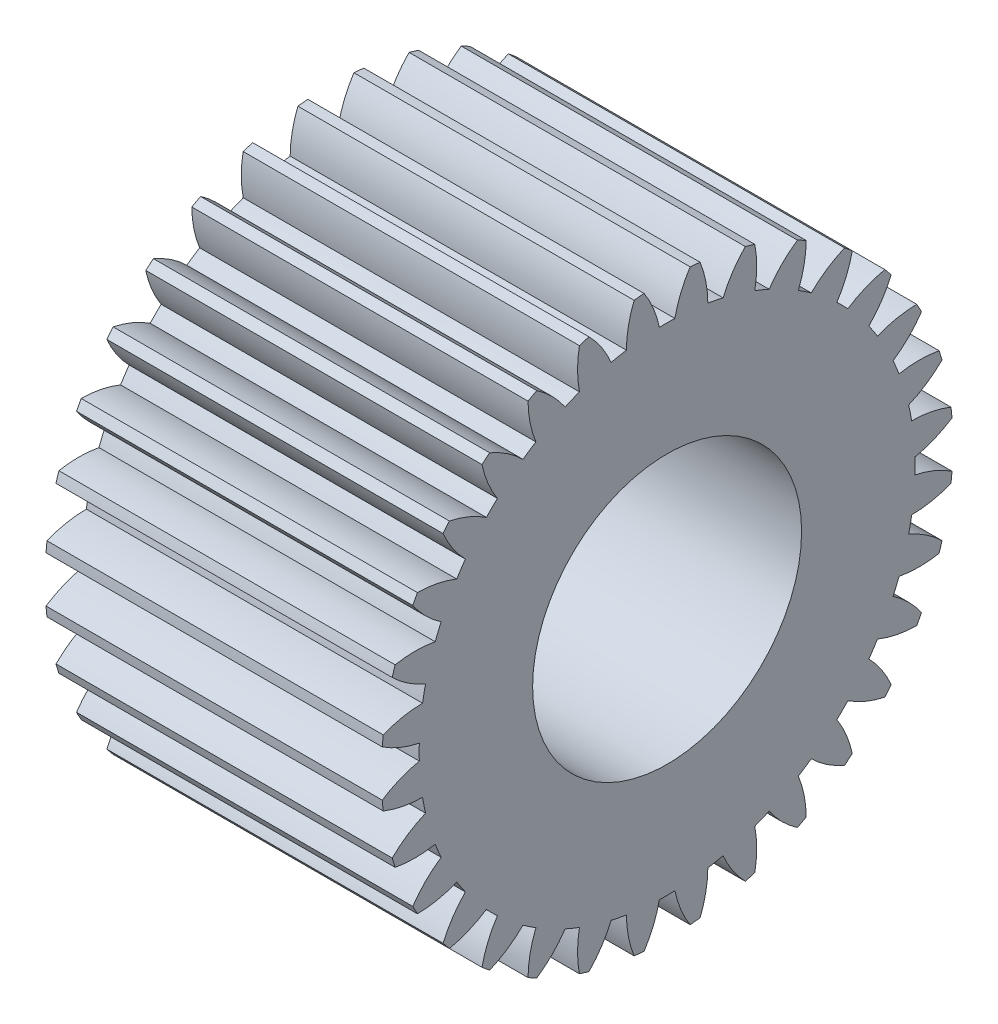
from build123d import *

# Parameters (mm, degrees)
BASPROSKE_W     = 10
BASPROSKE_H     = 8.5
TOOTHCUT_DEPTH  = 16.636495771
TEETHCUTS_COUNT = 32
TEETHCUTS_ANGLE = 348.75
BORSKE_R        = 4
BORE_DEPTH      = 50.0000508


with BuildPart() as part:
    # BasProSke → Base-Revolve (revolve)
    with BuildSketch(Plane(origin=(0, 0, 0), x_dir=(1, 0, 0), z_dir=(0, 1, 0)), mode=Mode.PRIVATE) as base_revolve_sk:
        with Locations((5, 4.25)):
            Rectangle(BASPROSKE_W, BASPROSKE_H)
    revolve(base_revolve_sk.sketch.rotate(Axis((-10, 0, 0), (1, 0, 0)), 180), axis=Axis((-10, 0, 0), (1, 0, 0)))

    # TooCutSke → ToothCut (cut, through all)
    with BuildSketch(Plane(origin=(0, 0, 0), x_dir=(0, 0, -1), z_dir=(1, 0, 0))):
        with BuildLine():
            ThreePointArc((0.230915662, 7.370383569), (0, 7.374), (-0.230915662, 7.370383569))
            ThreePointArc((-0.230915662, 7.370383569), (-0.411960263, 7.95607799), (-0.701370671, 8.496500712))
            ThreePointArc((-0.701370671, 8.496500712), (0, 8.5254), (0.701370671, 8.496500712))
            ThreePointArc((0.701370671, 8.496500712), (0.411960263, 7.95607799), (0.230915662, 7.370383569))
        make_face()
    toothcut = extrude(amount=TOOTHCUT_DEPTH, mode=Mode.SUBTRACT)

    # TeethCuts: ToothCut ×32 about axis
    teethcuts_axis = Axis((-10, 0, 0), (1, 0, 0))
    for i in range(1, TEETHCUTS_COUNT):
        add(toothcut.rotate(teethcuts_axis, i * TEETHCUTS_ANGLE / (TEETHCUTS_COUNT - 1)), mode=Mode.SUBTRACT)

    # BorSke → Bore (cut, symmetric)
    with BuildSketch(Plane(origin=(0, 0, 0), x_dir=(0, 0, -1), z_dir=(1, 0, 0))):
        with Locations(Location((0, 0, 0), (0, 0, 180))):
            Circle(BORSKE_R)
    extrude(amount=BORE_DEPTH, both=True, mode=Mode.SUBTRACT)


solid = part.part
